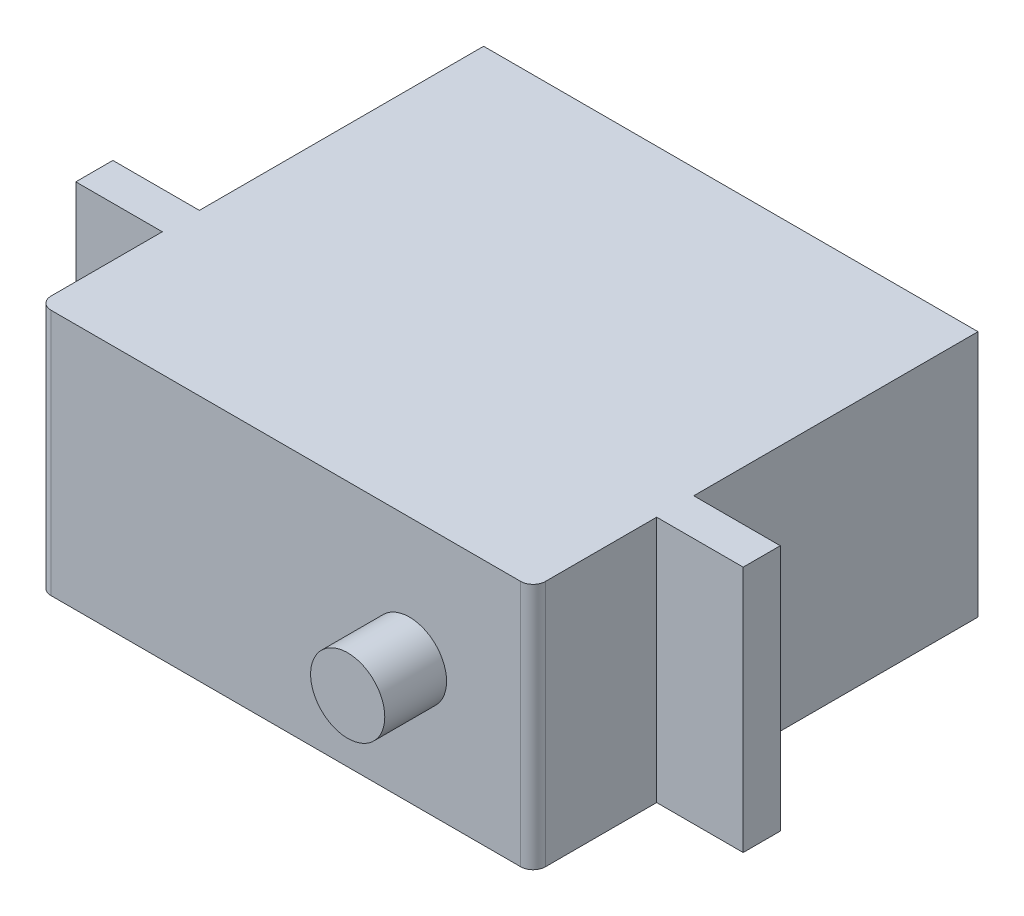
from build123d import *

# Parameters (mm, degrees)
ESQUISSE1_W        = 40
ESQUISSE1_H        = 20
BOSS_EXTRU_1_DEPTH = 36
ESQUISSE2_W        = 3
ESQUISSE2_H        = 20
BOSS_EXTRU_2_DEPTH = 7
ESQUISSE3_W        = 3
ESQUISSE3_H        = 20
BOSS_EXTRU_3_DEPTH = 7
ESQUISSE4_R        = 3
BOSS_EXTRU_4_DEPTH = 5
CONG_1_R           = 1


with BuildPart() as part:
    # Esquisse1 → Boss.-Extru.1 (new body)
    with BuildSketch(Plane.XY):
        with Locations((-4.886048962, 0.290697674)):
            Rectangle(ESQUISSE1_W, ESQUISSE1_H)
    extrude(amount=BOSS_EXTRU_1_DEPTH)

    # Esquisse2 → Boss.-Extru.2 (add)
    with BuildSketch(Plane(origin=(15.113951038, 0, 0), x_dir=(0, 0, -1), z_dir=(1, 0, 0))):
        with Locations((-24.5, 0.290697674)):
            Rectangle(ESQUISSE2_W, ESQUISSE2_H)
    extrude(amount=BOSS_EXTRU_2_DEPTH)

    # Esquisse3 → Boss.-Extru.3 (add)
    with BuildSketch(Plane.ZY.offset(24.886048962)):
        with Locations((24.5, 0.290697674)):
            Rectangle(ESQUISSE3_W, ESQUISSE3_H)
    extrude(amount=BOSS_EXTRU_3_DEPTH)

    # Esquisse4 → Boss.-Extru.4 (add)
    with BuildSketch(Plane.XY.offset(36)):
        with Locations((5.113951038, 0.290697674)):
            Circle(ESQUISSE4_R)
    extrude(amount=BOSS_EXTRU_4_DEPTH)

    # Congé1
    cong_1_edges = [part.edges().sort_by_distance(p)[0] for p in [
        (15.113951038, 0.290697674, 36),
        (-24.886048962, 0.290697674, 36),
    ]]
    fillet(cong_1_edges, radius=CONG_1_R)


solid = part.part
